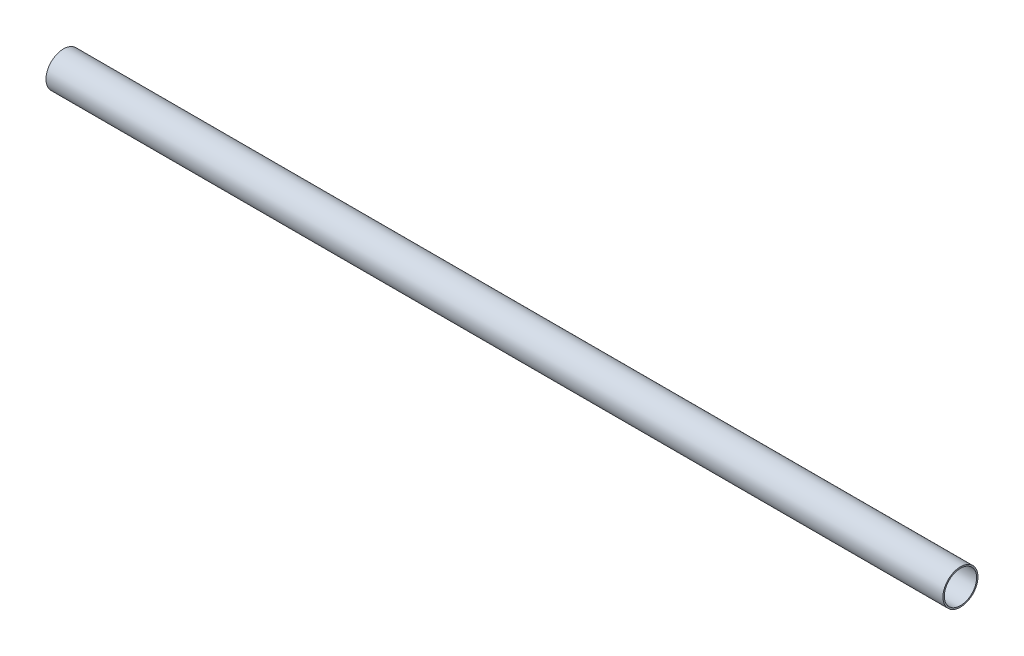
from build123d import *

# Parameters (mm, degrees)
CROQUIS1_R              = 25.4
CROQUIS1_R_2            = 23.4
SALIENTE_EXTRUIR1_DEPTH = 650


with BuildPart() as part:
    # Croquis1 → Saliente-Extruir1 (new, symmetric)
    with BuildSketch(Plane(origin=(0, 0, 0), x_dir=(0, 0, -1), z_dir=(1, 0, 0))):
        Circle(CROQUIS1_R)
        Circle(CROQUIS1_R_2, mode=Mode.SUBTRACT)
    extrude(amount=SALIENTE_EXTRUIR1_DEPTH, both=True)


solid = part.part
